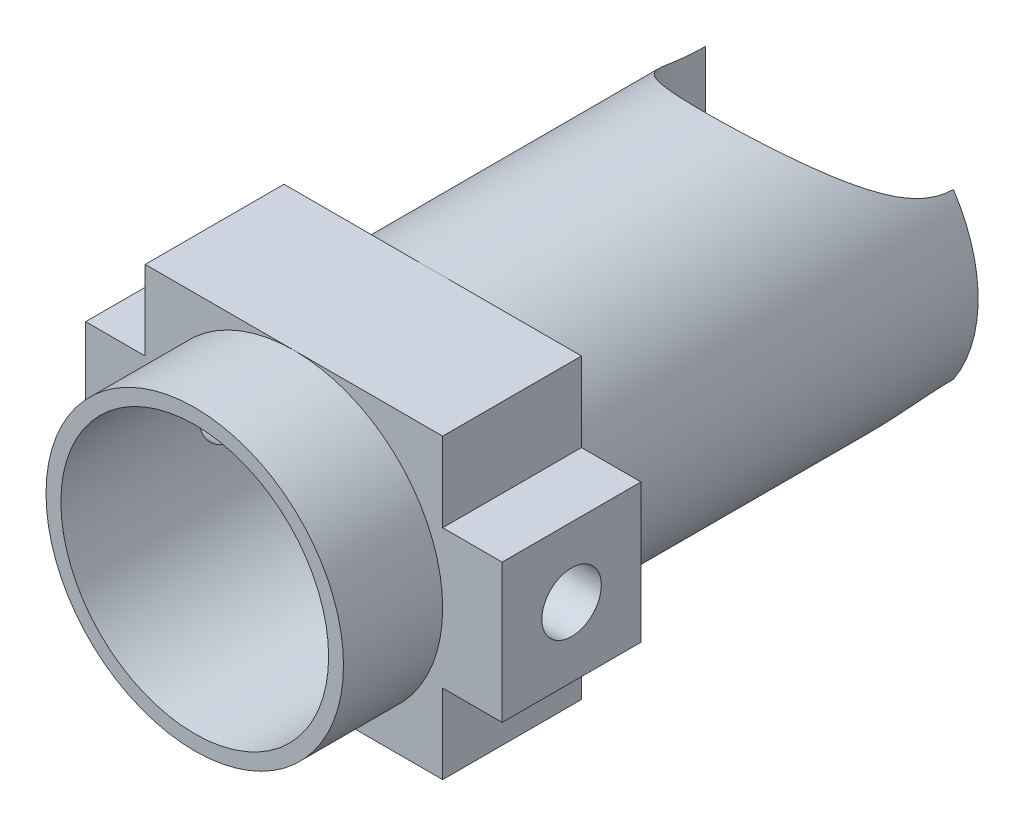
from build123d import *

# Parameters (mm, degrees)
SKETCH_1_R          = 13.5
EXTRUDE_1_DEPTH     = 14
SKETCH_2_R          = 15
SKETCH_2_R_2        = 13.5
EXTRUDE_2_DEPTH     = 10
EXTRUDE_START       = 40
SKETCH_3_R          = 15
EXTRUDE_3_DEPTH     = 40
SKETCH_4_R          = 10
CUT_EXTRUDE_1_DEPTH = 40
SKETCH_6_R          = 3
CUT_EXTRUDE_2_DEPTH = 66.299310931
SKETCH_7_R          = 12.5
CUT_EXTRUDE_3_DEPTH = 62.611687326


with BuildPart() as part:
    # Эскиз1 → Бобышка-Вытянуть1 (new body)
    with BuildSketch(Plane.XY):
        Polygon((0, 30), (0, 22), (-6, 22), (-6, 8), (0, 8), (0, 0), (30, 0), (30, 8), (36, 8), (36, 22), (30, 22), (30, 30), align=None)
        with Locations((15, 15)):
            Circle(SKETCH_1_R, mode=Mode.SUBTRACT)
    extrude(amount=EXTRUDE_1_DEPTH)

    # Эскиз2 → Бобышка-Вытянуть2 (add)
    with BuildSketch(Plane.XY.offset(14)):
        with Locations(Location((15, 15, 0), (0, 0, 270))):
            Circle(SKETCH_2_R)
        with Locations((15, 15)):
            Circle(SKETCH_2_R_2, mode=Mode.SUBTRACT)
    extrude(amount=EXTRUDE_2_DEPTH)

    # Эскиз3 → Бобышка-Вытянуть3 (add)
    with BuildSketch(Plane(origin=(0, 0, 0), x_dir=(-1, 0, 0), z_dir=(0, 0, -1)).offset(EXTRUDE_START)):
        with Locations(Location((-15, 15, 0), (0, 0, 270))):
            Circle(SKETCH_3_R)
    extrude(amount=-EXTRUDE_3_DEPTH)

    # Эскиз4 → Вырез-Вытянуть1 (cut)
    with BuildSketch(Plane(origin=(0, 0, -40), x_dir=(-1, 0, 0), z_dir=(0, 0, -1))):
        with Locations((-15, 15)):
            Circle(SKETCH_4_R)
    extrude(amount=-CUT_EXTRUDE_1_DEPTH, mode=Mode.SUBTRACT)

    # loft up to a face of the part (loft_1)
    loft([Face(Wire([part.edges().sort_by_distance((21.845471059, 22.289686274, -40))[0]])), Face(Wire([part.edges().sort_by_distance((5.75861407, 24.84107647, 0))[0]]))], mode=Mode.SUBTRACT)

    # Эскиз6 → Вырез-Вытянуть2 (cut, through all)
    with BuildSketch(Plane(origin=(36, 0, 0), x_dir=(0, 0, -1), z_dir=(1, 0, 0))):
        with Locations((-7, 15)):
            Circle(SKETCH_6_R)
    extrude(amount=-CUT_EXTRUDE_2_DEPTH, mode=Mode.SUBTRACT)

    # Эскиз7 → Вырез-Вытянуть3 (cut, through all)
    with BuildSketch(Plane(origin=(0, 30, 0), x_dir=(1, 0, 0), z_dir=(0, 1, 0))):
        with Locations((15, 40)):
            Circle(SKETCH_7_R)
    extrude(amount=-CUT_EXTRUDE_3_DEPTH, mode=Mode.SUBTRACT)


solid = part.part
